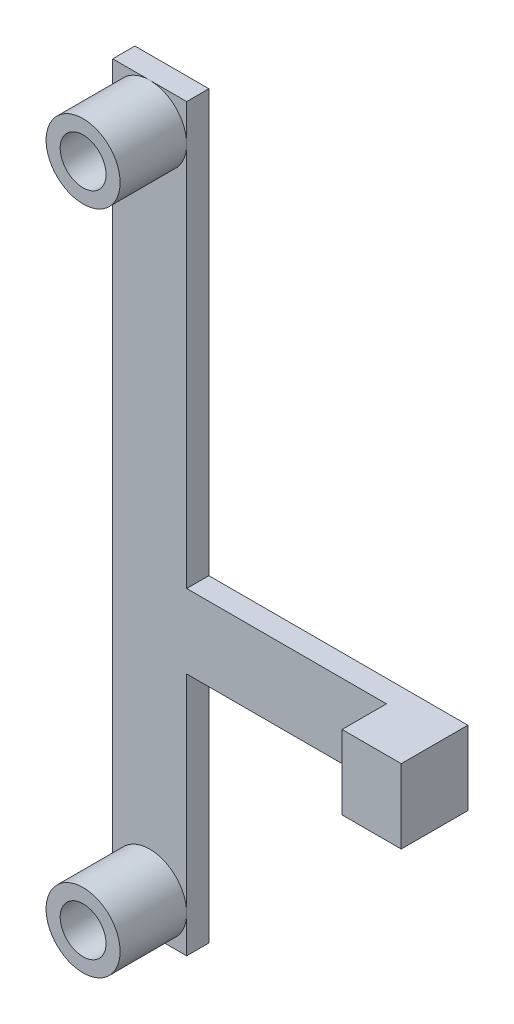
from build123d import *
from build123d.topology import SkipClean

# Parameters (mm, degrees)
SKETCH1_R           = 2.5
SKETCH1_R_2         = 1.55
BOSS_EXTRUDE1_DEPTH = 4.5
BOSS_EXTRUDE2_START = 1.5
SKETCH2_R           = 1.55
BOSS_EXTRUDE2_DEPTH = 1.5
SKETCH3_W           = 4
SKETCH3_H           = 5
BOSS_EXTRUDE3_DEPTH = 3
SKETCH4_R           = 2.5
BOSS_EXTRUDE4_DEPTH = 4.5
SKETCH5_R           = 1.55
CUT_EXTRUDE1_DEPTH  = 10.5


with BuildPart() as part:
    # Sketch1 → Boss-Extrude1 (new body)
    with BuildSketch(Plane.XY):
        with Locations((2.5, 2.5)):
            Circle(SKETCH1_R)
        with Locations((2.5, 2.5)):
            Circle(SKETCH1_R_2, mode=Mode.SUBTRACT)
    extrude(amount=BOSS_EXTRUDE1_DEPTH)

    # Sketch2 → Boss-Extrude2 (add)
    with SkipClean():  # the faces are left unmerged after this step: merging them gives an invalid solid
        with BuildSketch(Plane(origin=(0, 0, 0), x_dir=(-1, 0, 0), z_dir=(0, 0, -1)).offset(BOSS_EXTRUDE2_START)):
            Polygon((-5, 0), (0, 0), (0, 50), (-5, 50), (-5, 21.5), (-22.5, 21.5), (-22.5, 16.5), (-5, 16.5), align=None)
            with Locations((-2.5, 2.5)):
                Circle(SKETCH2_R, mode=Mode.SUBTRACT)
        extrude(amount=-BOSS_EXTRUDE2_DEPTH)

    # Sketch3 → Boss-Extrude3 (add)
    with SkipClean():  # the faces are left unmerged after this step: merging them gives an invalid solid
        with BuildSketch(Plane.XY):
            with Locations((20.5, 19)):
                Rectangle(SKETCH3_W, SKETCH3_H)
        extrude(amount=BOSS_EXTRUDE3_DEPTH)

    # Sketch4 → Boss-Extrude4 (add)
    with SkipClean():  # the faces are left unmerged after this step: merging them gives an invalid solid
        with BuildSketch(Plane.XY):
            with Locations((2.5, 47.5)):
                Circle(SKETCH4_R)
        extrude(amount=BOSS_EXTRUDE4_DEPTH)

    # Sketch5 → Cut-Extrude1 (cut)
    with SkipClean():  # the faces are left unmerged after this step: merging them gives an invalid solid
        with BuildSketch(Plane.XY.offset(4.5)):
            with Locations((2.5, 47.5)):
                Circle(SKETCH5_R)
        extrude(amount=-CUT_EXTRUDE1_DEPTH, mode=Mode.SUBTRACT)


solid = part.part
